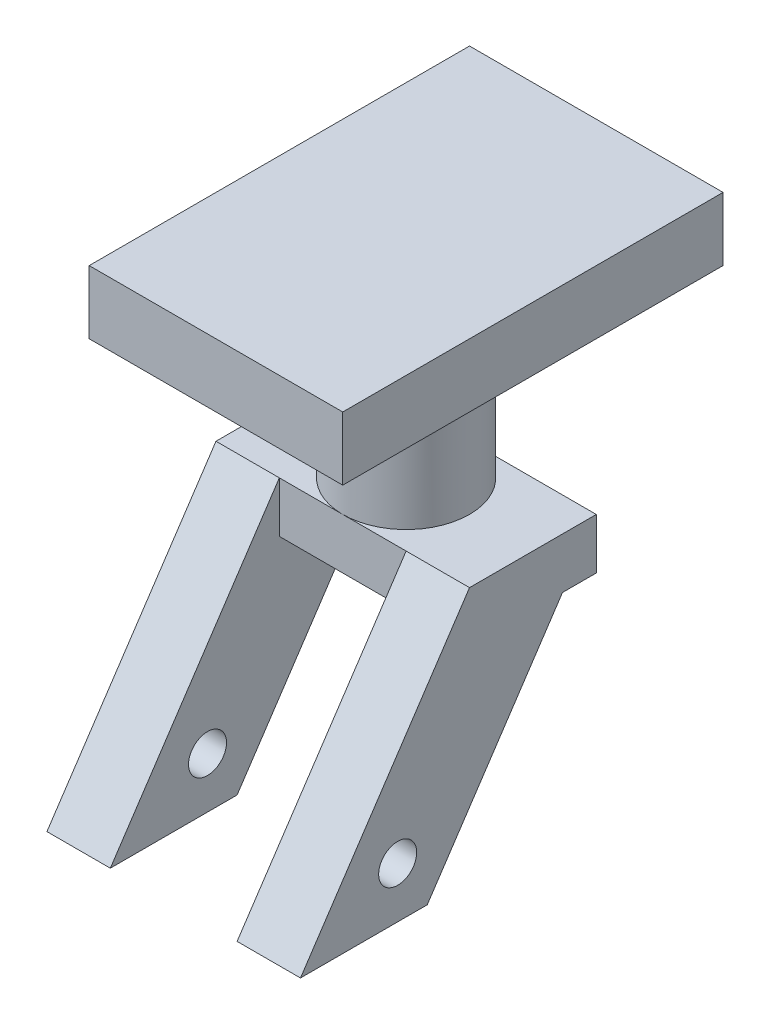
from build123d import *

# Parameters (mm, degrees)
SKETCH4_W           = 10
SKETCH4_H           = 15
BOSS_EXTRUDE3_DEPTH = 2.5
SKETCH5_R           = 2.5
BOSS_EXTRUDE4_DEPTH = 6
SKETCH6_W           = 10
SKETCH6_H           = 5
BOSS_EXTRUDE5_DEPTH = 2
BOSS_EXTRUDE6_DEPTH = 2.5
BOSS_EXTRUDE7_DEPTH = 2.5
SKETCH9_R           = 0.75
CUT_EXTRUDE1_DEPTH  = 21.97683908


with BuildPart() as part:
    # Sketch4 → Boss-Extrude3 (new body)
    with BuildSketch(Plane(origin=(0, 0, 0), x_dir=(1, 0, 0), z_dir=(0, 1, 0))):
        Rectangle(SKETCH4_W, SKETCH4_H)
    extrude(amount=BOSS_EXTRUDE3_DEPTH)

    # Sketch5 → Boss-Extrude4 (add)
    with BuildSketch(Plane.XZ):
        with Locations(Location((0, 0, 0), (0, 0, 270))):
            Circle(SKETCH5_R)
    extrude(amount=BOSS_EXTRUDE4_DEPTH)

    # Sketch6 → Boss-Extrude5 (add)
    with BuildSketch(Plane.XZ.offset(6)):
        Rectangle(SKETCH6_W, SKETCH6_H)
    extrude(amount=BOSS_EXTRUDE5_DEPTH)

    # Sketch7 → Boss-Extrude6 (add)
    with BuildSketch(Plane.ZY.offset(5)):
        Polygon((-2.5, -6), (2.5, -6), (9.166666667, -16), (4.166666667, -16), align=None)
    extrude(amount=-BOSS_EXTRUDE6_DEPTH)

    # Sketch8 → Boss-Extrude7 (add)
    with BuildSketch(Plane(origin=(5, 0, 0), x_dir=(0, 0, -1), z_dir=(1, 0, 0))):
        Polygon((2.5, -6), (-2.5, -6), (-9.166666667, -16), (-4.166666667, -16), align=None)
    extrude(amount=-BOSS_EXTRUDE7_DEPTH)

    # Sketch9 → Cut-Extrude1 (cut, through all)
    with BuildSketch(Plane.ZY.offset(5)):
        with Locations((5.333333333, -14)):
            Circle(SKETCH9_R)
    extrude(amount=-CUT_EXTRUDE1_DEPTH, mode=Mode.SUBTRACT)


solid = part.part
